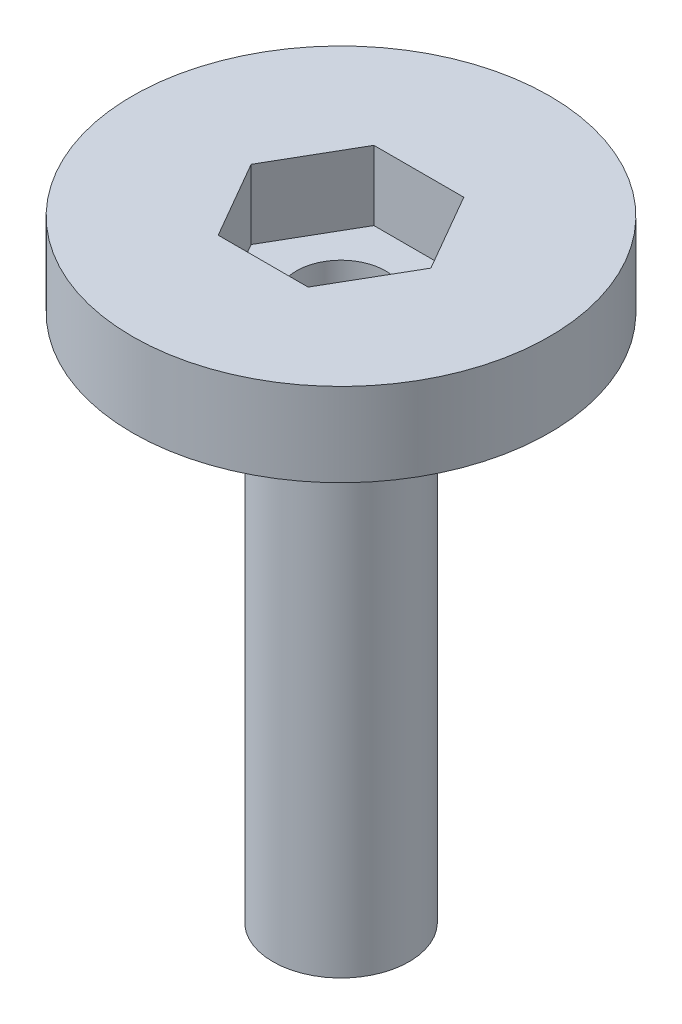
from build123d import *

# Parameters (mm, degrees)
SKETCH1_R           = 2.45
SKETCH1_R_2         = 1.6
BOSS_EXTRUDE1_DEPTH = 19
SKETCH2_R           = 7.5
BOSS_EXTRUDE2_DEPTH = 3
CUT_EXTRUDE1_REACH  = 26.423
SKETCH3_R           = 1.6
CUT_EXTRUDE2_DEPTH  = 2.5


with BuildPart() as part:
    # Sketch1 → Boss-Extrude1 (new body)
    with BuildSketch(Plane(origin=(0, 0, 0), x_dir=(1, 0, 0), z_dir=(0, 1, 0))):
        with Locations(Location((0, 0, 0), (0, 0, 270))):
            Circle(SKETCH1_R)
        with Locations(Location((0, 0, 0), (0, 0, 270))):
            Circle(SKETCH1_R_2, mode=Mode.SUBTRACT)
    extrude(amount=BOSS_EXTRUDE1_DEPTH)

    # Sketch2 → Boss-Extrude2 (add)
    with BuildSketch(Plane(origin=(0, 19, 0), x_dir=(1, 0, 0), z_dir=(0, 1, 0))):
        with Locations(Location((0, 0, 0), (0, 0, 270))):
            Circle(SKETCH2_R)
    extrude(amount=BOSS_EXTRUDE2_DEPTH)

    # Sketch3 → Cut-Extrude1 (cut, up to next)
    with BuildSketch(Plane(origin=(0, 22, 0), x_dir=(1, 0, 0), z_dir=(0, 1, 0)), mode=Mode.PRIVATE) as cut_extrude1_sk1:
        with Locations(Location((0, 0, 0), (0, 0, 270))):
            Circle(SKETCH3_R)
    cut_extrude1_tool1 = extrude(cut_extrude1_sk1.sketch, amount=-CUT_EXTRUDE1_REACH, mode=Mode.PRIVATE) & part.part
    add(cut_extrude1_tool1.solids().sort_by_distance((0, 22, 0))[0], mode=Mode.SUBTRACT)

    # Sketch4 → Cut-Extrude2 (cut)
    with BuildSketch(Plane(origin=(0, 22, 0), x_dir=(1, 0, 0), z_dir=(0, 1, 0))):
        Polygon((3.233161507, 0), (1.616580754, 2.8), (-1.616580754, 2.8), (-3.233161507, 0), (-1.616580754, -2.8), (1.616580754, -2.8), align=None)
    extrude(amount=-CUT_EXTRUDE2_DEPTH, mode=Mode.SUBTRACT)


solid = part.part
